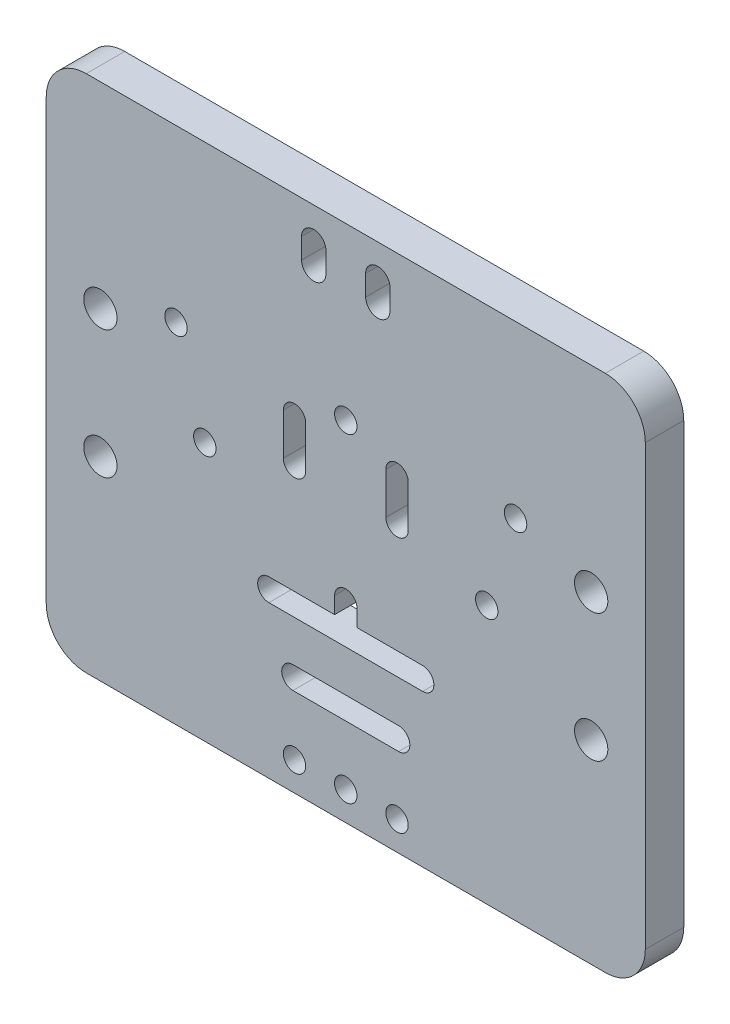
from build123d import *

# Parameters (mm, degrees)
MODEL_R                    = 1.75
BASE_DEPTH                 = 6
F_5_2_5_2_DIAMETER_HOLE1_D = 5.2


with BuildPart() as part:
    # Model → Base (new body)
    with BuildSketch(Plane.XY):
        with BuildLine():
            Line((46.75, 74.75), (46.75, 6.25))
            ThreePointArc((46.75, 6.25), (44.919417382, 1.830582618), (40.5, 0))
            Line((40.5, 0), (-40.5, 0))
            ThreePointArc((-40.5, 0), (-44.919417382, 1.830582618), (-46.75, 6.25))
            Line((-46.75, 6.25), (-46.75, 74.75))
            ThreePointArc((-46.75, 74.75), (-44.919417382, 79.169417382), (-40.5, 81))
            Line((-40.5, 81), (40.5, 81))
            ThreePointArc((40.5, 81), (44.919417382, 79.169417382), (46.75, 74.75))
        make_face()
        with Locations((0, 4.5)):
            Circle(MODEL_R, mode=Mode.SUBTRACT)
        with Locations((8, 4.5)):
            Circle(MODEL_R, mode=Mode.SUBTRACT)
        with Locations((-8, 4.5)):
            Circle(MODEL_R, mode=Mode.SUBTRACT)
        with Locations((0, 54.4)):
            Circle(MODEL_R, mode=Mode.SUBTRACT)
        with Locations((26.5, 54.4)):
            Circle(MODEL_R, mode=Mode.SUBTRACT)
        with Locations((22, 40.4)):
            Circle(MODEL_R, mode=Mode.SUBTRACT)
        with Locations((-22, 40.4)):
            Circle(MODEL_R, mode=Mode.SUBTRACT)
        with Locations((-26.5, 54.4)):
            Circle(MODEL_R, mode=Mode.SUBTRACT)
        with BuildLine():
            Line((-3.1, 75.8), (-3.1, 72.6))
            ThreePointArc((-3.1, 72.6), (-5, 70.7), (-6.9, 72.6))
            Line((-6.9, 72.6), (-6.9, 75.8))
            ThreePointArc((-6.9, 75.8), (-5, 77.7), (-3.1, 75.8))
        make_face(mode=Mode.SUBTRACT)
        with BuildLine():
            Line((-9.75, 50.9), (-9.75, 44.4))
            ThreePointArc((-9.75, 44.4), (-8, 42.65), (-6.25, 44.4))
            Line((-6.25, 44.4), (-6.25, 50.9))
            ThreePointArc((-6.25, 50.9), (-8, 52.65), (-9.75, 50.9))
        make_face(mode=Mode.SUBTRACT)
        with BuildLine():
            Line((3.1, 72.6), (3.1, 75.8))
            ThreePointArc((3.1, 75.8), (5, 77.7), (6.9, 75.8))
            Line((6.9, 75.8), (6.9, 72.6))
            ThreePointArc((6.9, 72.6), (5, 70.7), (3.1, 72.6))
        make_face(mode=Mode.SUBTRACT)
        with BuildLine():
            Line((8.25, 17.25), (-8.25, 17.25))
            ThreePointArc((-8.25, 17.25), (-10, 15.5), (-8.25, 13.75))
            Line((-8.25, 13.75), (8.25, 13.75))
            ThreePointArc((8.25, 13.75), (10, 15.5), (8.25, 17.25))
        make_face(mode=Mode.SUBTRACT)
        with BuildLine():
            Line((9.75, 44.4), (9.75, 50.9))
            ThreePointArc((9.75, 50.9), (8, 52.65), (6.25, 50.9))
            Line((6.25, 50.9), (6.25, 44.4))
            ThreePointArc((6.25, 44.4), (8, 42.65), (9.75, 44.4))
        make_face(mode=Mode.SUBTRACT)
        with BuildLine():
            Line((-1.75, 29.85), (-1.75, 27.25))
            Line((-1.75, 27.25), (-12, 27.25))
            ThreePointArc((-12, 27.25), (-13.75, 25.5), (-12, 23.75))
            Line((-12, 23.75), (12, 23.75))
            ThreePointArc((12, 23.75), (13.75, 25.5), (12, 27.25))
            Line((12, 27.25), (1.75, 27.25))
            Line((1.75, 27.25), (1.75, 29.85))
            ThreePointArc((1.75, 29.85), (0, 31.6), (-1.75, 29.85))
        make_face(mode=Mode.SUBTRACT)
    extrude(amount=BASE_DEPTH)

    # Ø5.2 (5.2) Diameter Hole1 (through all)
    with Locations(Plane.XY.offset(6)):
        with Locations((-38.3, 50.35), (-38.3, 30.35), (38.3, 30.35), (38.3, 50.35)):
            Hole(F_5_2_5_2_DIAMETER_HOLE1_D / 2)


solid = part.part
